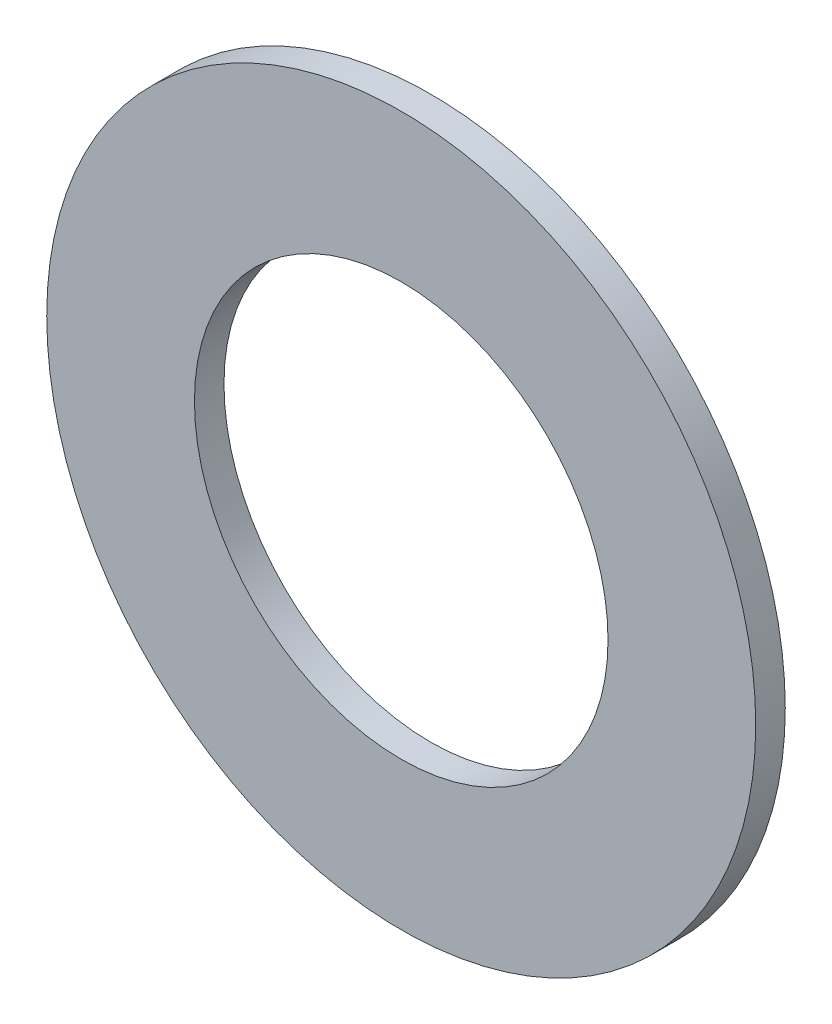
from build123d import *

# Parameters (mm, degrees)
SKETCH1_R           = 76.2
SKETCH1_R_2         = 44.45
BOSS_EXTRUDE1_DEPTH = 6.35


with BuildPart() as part:
    # Sketch1 → Boss-Extrude1 (new body)
    with BuildSketch(Plane.XY):
        Circle(SKETCH1_R)
        Circle(SKETCH1_R_2, mode=Mode.SUBTRACT)
    extrude(amount=BOSS_EXTRUDE1_DEPTH)


solid = part.part
